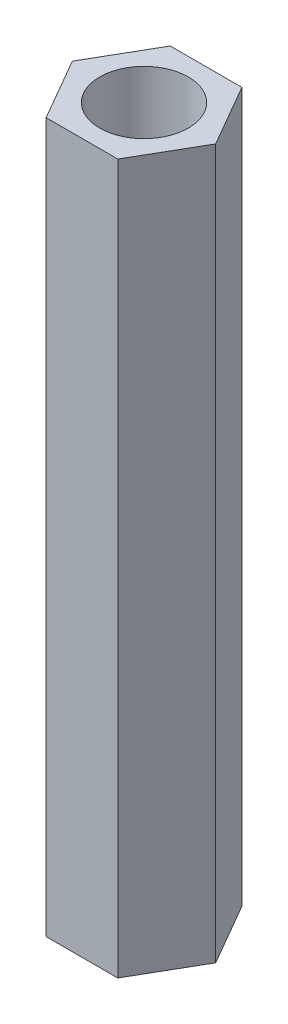
from build123d import *

# Parameters (mm, degrees)
SKETCH_1_R      = 2.5
EXTRUDE_1_DEPTH = 40


with BuildPart() as part:
    # 草图1 → 凸台-拉伸1 (new body)
    with BuildSketch(Plane(origin=(0, 0, 0), x_dir=(1, 0, 0), z_dir=(0, 1, 0))):
        Polygon((2.020725942, 3.5), (-2.020725942, 3.5), (-4.041451884, 0), (-2.020725942, -3.5), (2.020725942, -3.5), (4.041451884, 0), align=None)
        with Locations(Location((0, 0, 0), (0, 0, 270))):
            Circle(SKETCH_1_R, mode=Mode.SUBTRACT)
    extrude(amount=EXTRUDE_1_DEPTH)


solid = part.part
